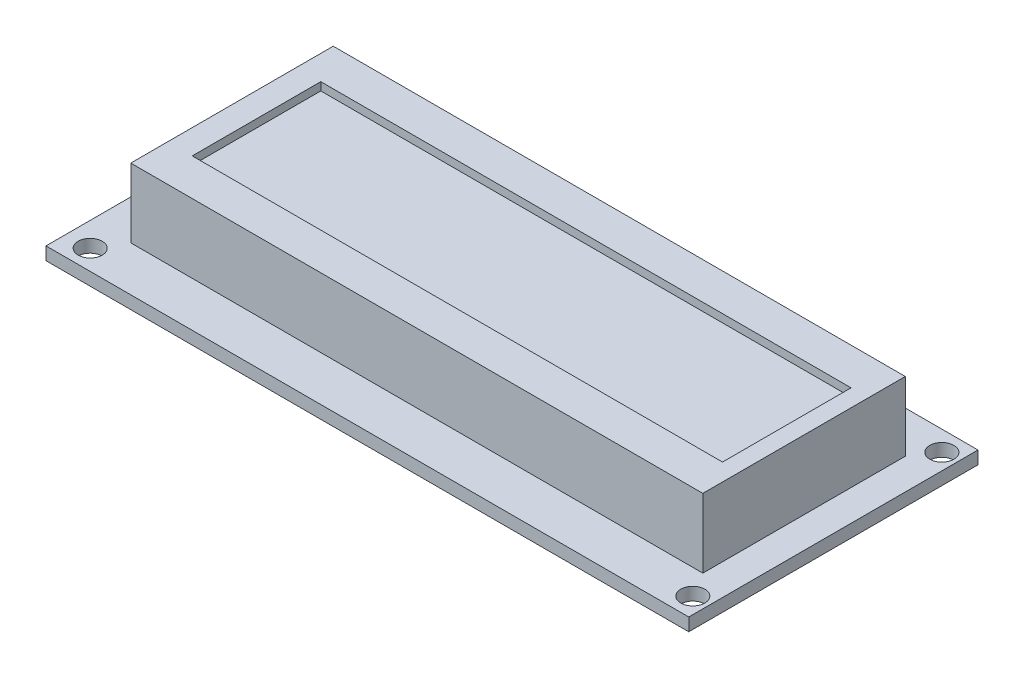
from build123d import *

# Parameters (mm, degrees)
SKETCH1_W           = 80
SKETCH1_H           = 36
BOSS_EXTRUDE1_DEPTH = 1.6
SKETCH2_W           = 71.2
SKETCH2_H           = 25.2
BOSS_EXTRUDE2_DEPTH = 8.6
SKETCH3_R           = 1.5
CUT_EXTRUDE3_DEPTH  = 13.2
SKETCH6_W           = 66
SKETCH6_H           = 16
CUT_EXTRUDE4_DEPTH  = 1
SKETCH7_R           = 0.5
CUT_EXTRUDE5_DEPTH  = 21


with BuildPart() as part:
    # Sketch1 → Boss-Extrude1 (new body)
    with BuildSketch(Plane(origin=(0, 0, 0), x_dir=(1, 0, 0), z_dir=(0, 1, 0))):
        with Locations((3.287671233, 10.219178082)):
            Rectangle(SKETCH1_W, SKETCH1_H)
    extrude(amount=BOSS_EXTRUDE1_DEPTH)

    # Sketch2 → Boss-Extrude2 (add)
    with BuildSketch(Plane(origin=(0, 1.6, 0), x_dir=(1, 0, 0), z_dir=(0, 1, 0))):
        with Locations((3.837671233, 10.419178082)):
            Rectangle(SKETCH2_W, SKETCH2_H)
    extrude(amount=BOSS_EXTRUDE2_DEPTH)

    # Sketch3 → Cut-Extrude3 (cut)
    with BuildSketch(Plane(origin=(0, 1.6, 0), x_dir=(1, 0, 0), z_dir=(0, 1, 0))):
        with Locations(Location((-33.712328767, 25.719178082, 0), (0, 0, 270))):
            Circle(SKETCH3_R)
        with Locations(Location((41.287671233, 25.719178082, 0), (0, 0, 270))):
            Circle(SKETCH3_R)
        with Locations(Location((-33.712328767, -5.280821918, 0), (0, 0, 270))):
            Circle(SKETCH3_R)
        with Locations(Location((41.287671233, -5.280821918, 0), (0, 0, 270))):
            Circle(SKETCH3_R)
    extrude(amount=-CUT_EXTRUDE3_DEPTH, mode=Mode.SUBTRACT)

    # Sketch6 → Cut-Extrude4 (cut)
    with BuildSketch(Plane(origin=(0, 10.2, 0), x_dir=(1, 0, 0), z_dir=(0, 1, 0))):
        with Locations((4.287671233, 10.419178082)):
            Rectangle(SKETCH6_W, SKETCH6_H)
    extrude(amount=-CUT_EXTRUDE4_DEPTH, mode=Mode.SUBTRACT)

    # Sketch7 → Cut-Extrude5 (cut)
    with BuildSketch(Plane(origin=(0, 1.6, 0), x_dir=(1, 0, 0), z_dir=(0, 1, 0))):
        with Locations(Location((-28.712328767, 25.719178082, 0), (0, 0, 270))):
            Circle(SKETCH7_R)
        with Locations(Location((-26.172328767, 25.719178082, 0), (0, 0, 270))):
            Circle(SKETCH7_R)
        with Locations(Location((-23.632328767, 25.719178082, 0), (0, 0, 270))):
            Circle(SKETCH7_R)
        with Locations(Location((-21.092328767, 25.719178082, 0), (0, 0, 270))):
            Circle(SKETCH7_R)
        with Locations(Location((-18.552328767, 25.719178082, 0), (0, 0, 270))):
            Circle(SKETCH7_R)
        with Locations(Location((-16.012328767, 25.719178082, 0), (0, 0, 270))):
            Circle(SKETCH7_R)
        with Locations(Location((-13.472328767, 25.719178082, 0), (0, 0, 270))):
            Circle(SKETCH7_R)
        with Locations(Location((-10.932328767, 25.719178082, 0), (0, 0, 270))):
            Circle(SKETCH7_R)
        with Locations(Location((-8.392328767, 25.719178082, 0), (0, 0, 270))):
            Circle(SKETCH7_R)
        with Locations(Location((-5.852328767, 25.719178082, 0), (0, 0, 270))):
            Circle(SKETCH7_R)
        with Locations(Location((-3.312328767, 25.719178082, 0), (0, 0, 270))):
            Circle(SKETCH7_R)
        with Locations(Location((-0.772328767, 25.719178082, 0), (0, 0, 270))):
            Circle(SKETCH7_R)
        with Locations(Location((1.767671233, 25.719178082, 0), (0, 0, 270))):
            Circle(SKETCH7_R)
        with Locations(Location((4.307671233, 25.719178082, 0), (0, 0, 270))):
            Circle(SKETCH7_R)
        with Locations(Location((6.847671233, 25.719178082, 0), (0, 0, 270))):
            Circle(SKETCH7_R)
        with Locations(Location((9.387671233, 25.719178082, 0), (0, 0, 270))):
            Circle(SKETCH7_R)
    extrude(amount=-CUT_EXTRUDE5_DEPTH, mode=Mode.SUBTRACT)


solid = part.part
